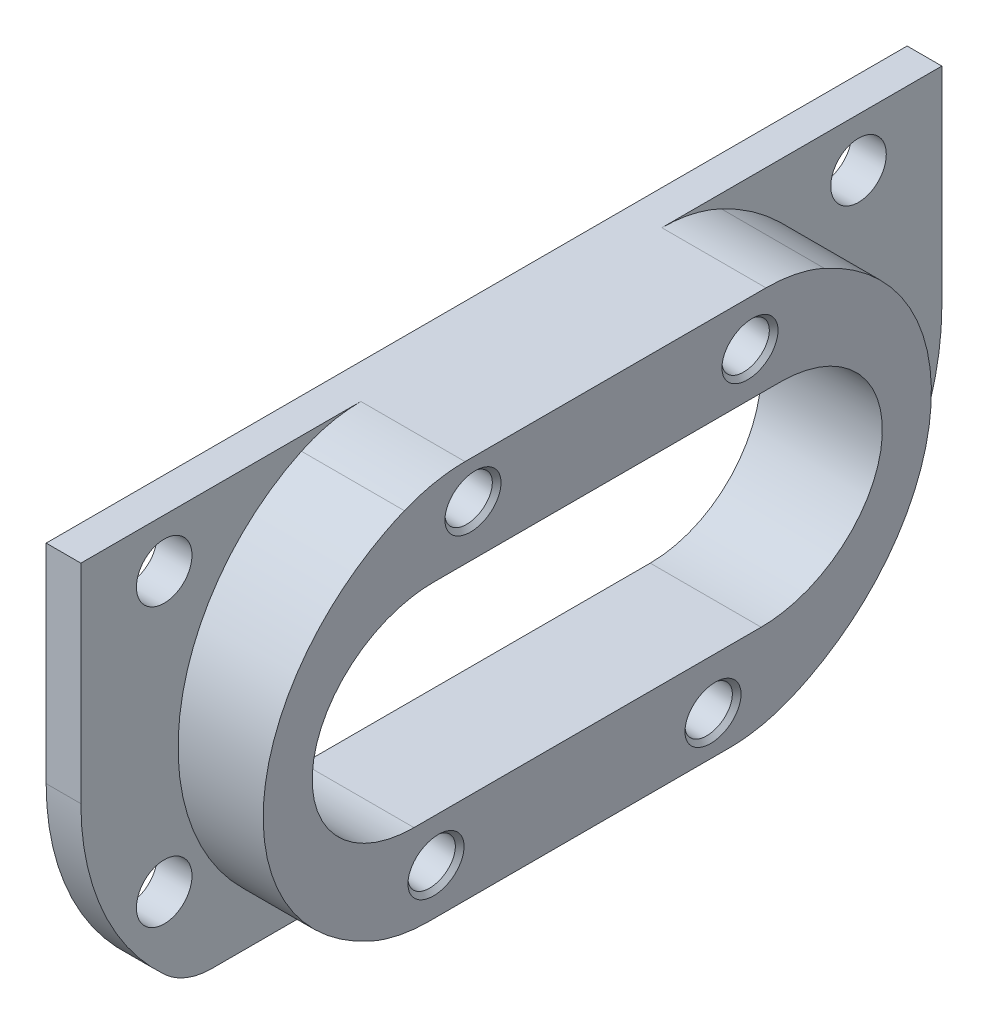
from build123d import *

# Parameters (mm, degrees)
SZKIC1_R                                   = 4
DODANIE_WYCI_GNI_CIE1_DEPTH                = 20
SZKIC2_OUTSIDE_W                           = 153.84
SZKIC2_OUTSIDE_H                           = 89.84
WYTNIJ_WYCI_GNI_CIE1_DEPTH                 = 15
WYTNIJ_WYCI_GNI_CIE2_DEPTH                 = 130.135587659
WYTNIJ_WYCI_GNI_CIE2_DEPTH_BACK            = 130.135587659
OTW_R_GWINTOWANY_M81_D                     = 6.8
OTW_R_GWINTOWANY_M81_DEPTH                 = 12.957073895
OTW_R_GWINTOWANY_M81_CSINK_D               = 8.05
OTW_R_GWINTOWANY_M81_CSINK_ANGLE           = 90
OTW_R_GWINTOWANY_M81_TIP                   = 2.042926105
OTW_R_GWINTOWANY_M81_ON_FACE_2_D           = 6.8
OTW_R_GWINTOWANY_M81_ON_FACE_2_DEPTH       = 12.957073895
OTW_R_GWINTOWANY_M81_ON_FACE_2_CSINK_D     = 8.05
OTW_R_GWINTOWANY_M81_ON_FACE_2_CSINK_ANGLE = 90
OTW_R_GWINTOWANY_M81_ON_FACE_2_TIP         = 2.042926105


with BuildPart() as part:
    # Szkic1 → Dodanie-wyciągnięcie1 (new body)
    with BuildSketch(Plane(origin=(0, 0, 0), x_dir=(0, 0, -1), z_dir=(1, 0, 0))):
        with BuildLine():
            Line((-43.138357147, -30), (43.138357147, -30))
            ThreePointArc((43.138357147, -30), (46.738768646, -29.329364235), (49.856267202, -27.407407407))
            ThreePointArc((49.856267202, -27.407407407), (58.828108774, -14.988630917), (62, 0))
            Line((62, 0), (62, 30))
            Line((62, 30), (-62, 30))
            Line((-62, 30), (-62, 0))
            ThreePointArc((-62, 0), (-58.828108774, -14.988630917), (-49.856267202, -27.407407407))
            ThreePointArc((-49.856267202, -27.407407407), (-46.738768646, -29.329364235), (-43.138357147, -30))
        make_face()
        with Locations((-50, 23)):
            Circle(SZKIC1_R, mode=Mode.SUBTRACT)
        with Locations((50, 23)):
            Circle(SZKIC1_R, mode=Mode.SUBTRACT)
        with Locations((50, -17)):
            Circle(SZKIC1_R, mode=Mode.SUBTRACT)
        with Locations((-50, -17)):
            Circle(SZKIC1_R, mode=Mode.SUBTRACT)
        with BuildLine():
            Line((-25, -16), (25, -16))
            ThreePointArc((25, -16), (41, 0), (25, 16))
            Line((25, 16), (-25, 16))
            ThreePointArc((-25, 16), (-41, 0), (-25, -16))
        make_face(mode=Mode.SUBTRACT)
    extrude(amount=DODANIE_WYCI_GNI_CIE1_DEPTH)

    # Szkic2 outside → Wytnij-wyciągnięcie1 (cut)
    # profile 1 of 2: a face of its own
    with BuildSketch(Plane(origin=(20, 0, 0), x_dir=(0, 0, -1), z_dir=(1, 0, 0))):
        Rectangle(SZKIC2_OUTSIDE_W, SZKIC2_OUTSIDE_H)
        with BuildLine():
            Line((21.671768561, 30), (-21.671768561, 30))
            ThreePointArc((-21.671768561, 30), (-26.059642547, 29.512728202), (-30.233707808, 28.074656189))
            ThreePointArc((-30.233707808, 28.074656189), (-48, 0), (-30.233707808, -28.074656189))
            ThreePointArc((-30.233707808, -28.074656189), (-26.059642547, -29.512728202), (-21.671768561, -30))
            Line((-21.671768561, -30), (21.671768561, -30))
            ThreePointArc((21.671768561, -30), (26.059642547, -29.512728202), (30.233707808, -28.074656189))
            ThreePointArc((30.233707808, -28.074656189), (48, 0), (30.233707808, 28.074656189))
            ThreePointArc((30.233707808, 28.074656189), (26.059642547, 29.512728202), (21.671768561, 30))
        make_face(mode=Mode.SUBTRACT)
    # profile 2 of 2: a face of its own
    with BuildSketch(Plane(origin=(20, 0, 0), x_dir=(0, 0, -1), z_dir=(1, 0, 0))):
        with BuildLine():
            Line((-25, -16), (25, -16))
            ThreePointArc((25, -16), (41, 0), (25, 16))
            Line((25, 16), (-25, 16))
            ThreePointArc((-25, 16), (-41, 0), (-25, -16))
        make_face()
    extrude(amount=-WYTNIJ_WYCI_GNI_CIE1_DEPTH, mode=Mode.SUBTRACT)

    # Szkic3 → Wytnij-wyciągnięcie2 (cut, two sides: drawn at the far end of the back side and taken through both)
    with BuildSketch(Plane(origin=(0, 0, -62), x_dir=(-1, 0, 0), z_dir=(0, 0, -1)).offset(-WYTNIJ_WYCI_GNI_CIE2_DEPTH_BACK)):
        Polygon((-20, 30), (-14.750680188, -30), (-20, -30), align=None)
    extrude(amount=WYTNIJ_WYCI_GNI_CIE2_DEPTH + WYTNIJ_WYCI_GNI_CIE2_DEPTH_BACK, mode=Mode.SUBTRACT)

    # Otwór gwintowany M81
    with Locations(Plane(origin=(19.469847212, 23.940325899, 20), x_dir=(0.087155742748, 0.996194698092, 0), z_dir=(0.996194698092, -0.087155742748, 0))):
        with Locations((0, 0), (-1.047077932, -39.986292999)):
            CounterSinkHole(OTW_R_GWINTOWANY_M81_D / 2, OTW_R_GWINTOWANY_M81_CSINK_D / 2, depth=OTW_R_GWINTOWANY_M81_DEPTH, counter_sink_angle=OTW_R_GWINTOWANY_M81_CSINK_ANGLE)
            with Locations((0, 0, -(OTW_R_GWINTOWANY_M81_DEPTH + OTW_R_GWINTOWANY_M81_TIP / 2))):  # 118° drill point
                Cone(0, OTW_R_GWINTOWANY_M81_D / 2, OTW_R_GWINTOWANY_M81_TIP, mode=Mode.SUBTRACT)

    # Otwór gwintowany M81 on face 2
    with Locations(Plane(origin=(15.374931009, -22.864780472, 21.23031657), x_dir=(0.087155971833, 0.996194678049, 0), z_dir=(0.996194678049, -0.087155971833, 0))):
        with Locations((0, 0), (-1.047077932, -39.986292999)):
            CounterSinkHole(OTW_R_GWINTOWANY_M81_ON_FACE_2_D / 2, OTW_R_GWINTOWANY_M81_ON_FACE_2_CSINK_D / 2, depth=OTW_R_GWINTOWANY_M81_ON_FACE_2_DEPTH, counter_sink_angle=OTW_R_GWINTOWANY_M81_ON_FACE_2_CSINK_ANGLE)
            with Locations((0, 0, -(OTW_R_GWINTOWANY_M81_ON_FACE_2_DEPTH + OTW_R_GWINTOWANY_M81_ON_FACE_2_TIP / 2))):  # 118° drill point
                Cone(0, OTW_R_GWINTOWANY_M81_ON_FACE_2_D / 2, OTW_R_GWINTOWANY_M81_ON_FACE_2_TIP, mode=Mode.SUBTRACT)


solid = part.part
